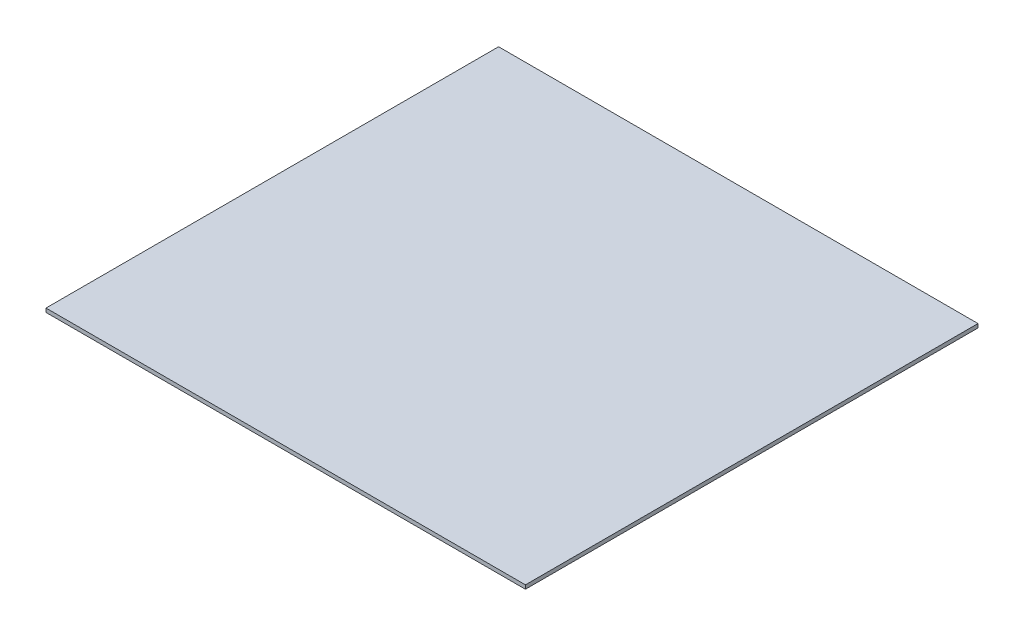
from build123d import *

# Parameters (mm, degrees)
SKETCH1_W           = 625
SKETCH1_H           = 590
BOSS_EXTRUDE1_DEPTH = 5


with BuildPart() as part:
    # Sketch1 → Boss-Extrude1 (new body)
    with BuildSketch(Plane(origin=(0, 0, 0), x_dir=(1, 0, 0), z_dir=(0, 1, 0))):
        Rectangle(SKETCH1_W, SKETCH1_H)
    extrude(amount=BOSS_EXTRUDE1_DEPTH)


solid = part.part
